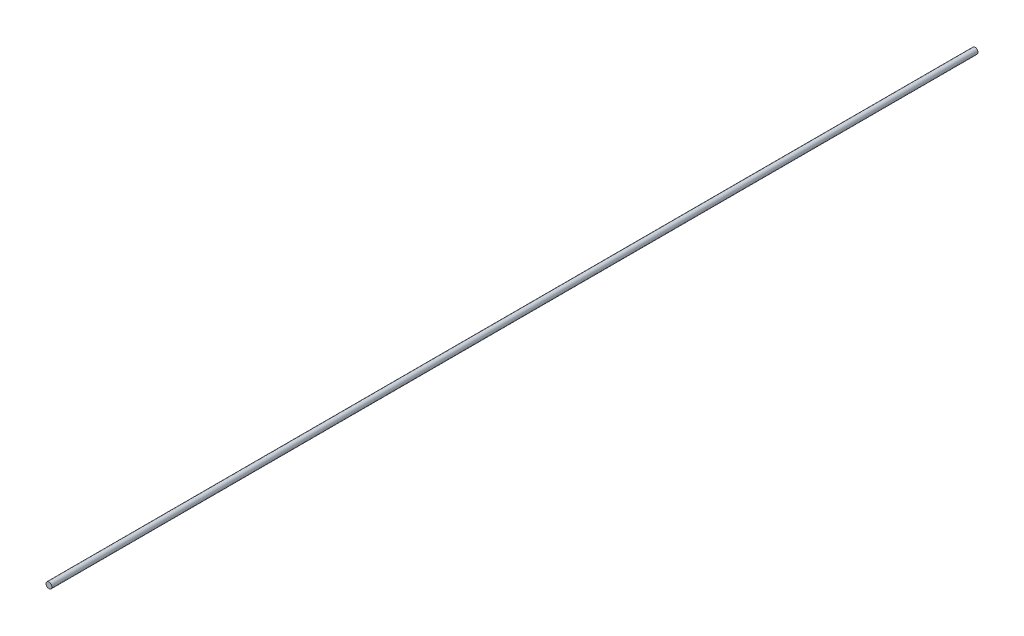
from build123d import *

# Parameters (mm, degrees)
SKETCH_1_R = 0.4
D0P8_DEPTH = 126.290856353


with BuildPart() as part:
    # 草图1 → D0p8可调钢索_水平姿态跨度 (new body)
    with BuildSketch(Plane.XY):
        Circle(SKETCH_1_R)
    extrude(amount=D0P8_DEPTH)


solid = part.part
